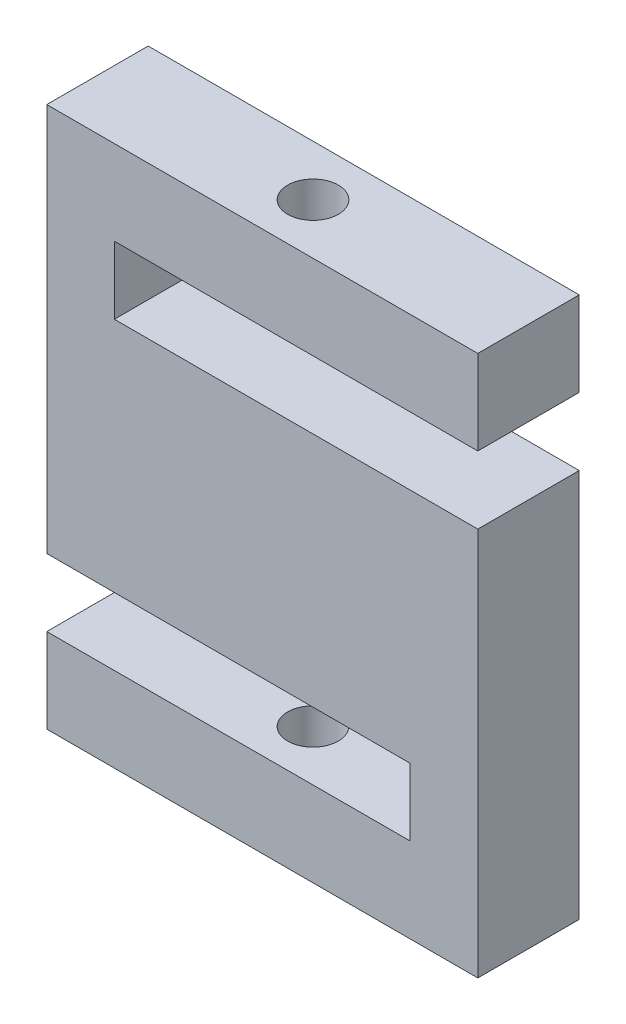
from build123d import *

# Parameters (mm, degrees)
DODANIE_WYCI_GNI_CIE1_DEPTH = 12
WYTNIJ_WYCI_GNI_CIE1_START  = 32
SZKIC2_R                    = 3
WYTNIJ_WYCI_GNI_CIE1_DEPTH  = 12
WYTNIJ_WYCI_GNI_CIE2_START  = -20
SZKIC2_2_R                  = 3
WYTNIJ_WYCI_GNI_CIE2_DEPTH  = 12


with BuildPart() as part:
    # Szkic1 → Dodanie-wyciągnięcie1 (new body)
    with BuildSketch(Plane.XY):
        Polygon((-25.5, -22), (-25.5, -32), (25.5, -32), (25.5, 14), (-17.5, 14), (-17.5, 22), (25.5, 22), (25.5, 32), (-25.5, 32), (-25.5, -14), (17.5, -14), (17.5, -21.960784314), align=None)
    extrude(amount=DODANIE_WYCI_GNI_CIE1_DEPTH)

    # Szkic2 → Wytnij-wyciągnięcie1 (cut)
    with BuildSketch(Plane(origin=(0, 0, 0), x_dir=(1, 0, 0), z_dir=(0, 1, 0)).offset(WYTNIJ_WYCI_GNI_CIE1_START)):
        with Locations(Location((0, -6, 0), (0, 0, 270))):
            Circle(SZKIC2_R)
    extrude(amount=-WYTNIJ_WYCI_GNI_CIE1_DEPTH, mode=Mode.SUBTRACT)

    # Szkic2<2> → Wytnij-wyciągnięcie2 (cut)
    with BuildSketch(Plane(origin=(0, 0, 0), x_dir=(1, 0, 0), z_dir=(0, 1, 0)).offset(WYTNIJ_WYCI_GNI_CIE2_START)):
        with Locations(Location((0, -6, 0), (0, 0, 270))):
            Circle(SZKIC2_2_R)
    extrude(amount=-WYTNIJ_WYCI_GNI_CIE2_DEPTH, mode=Mode.SUBTRACT)


solid = part.part
